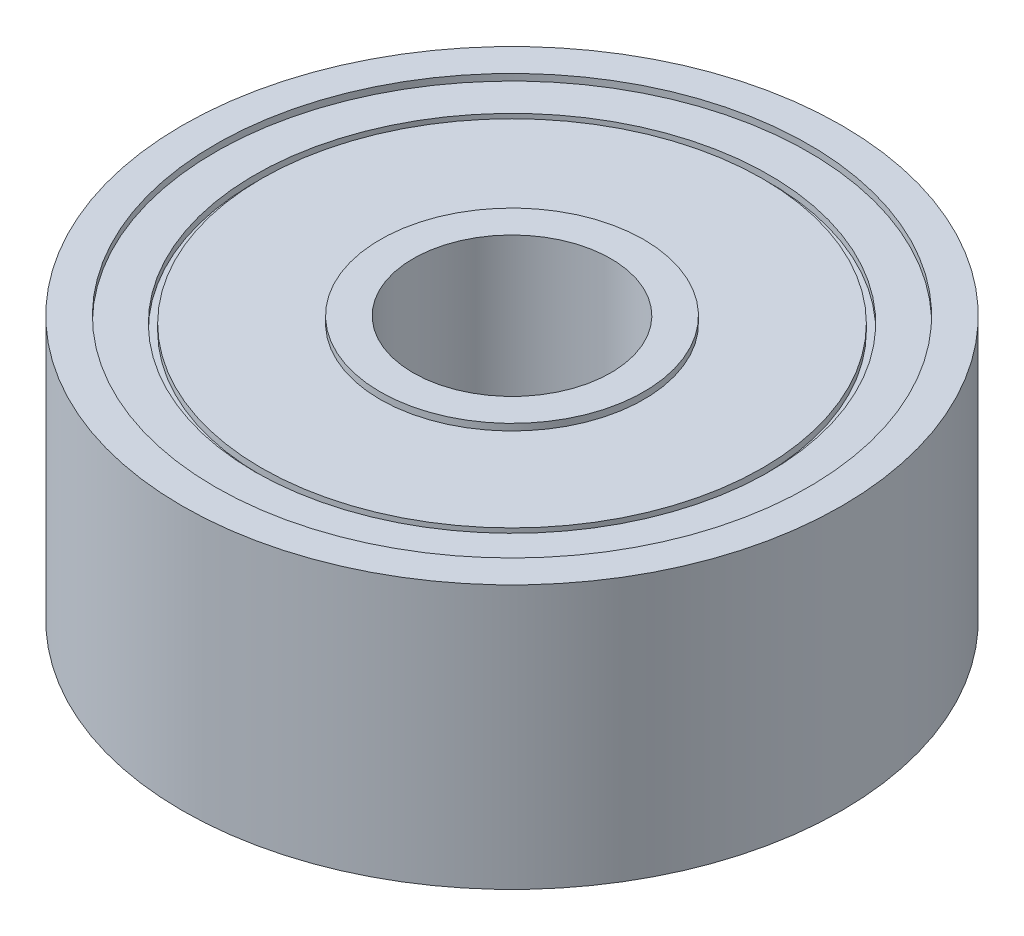
from build123d import *

# Parameters (mm, degrees)
SKETCH_1_R          = 5
SKETCH_1_R_2        = 1.5
EXTRUDE_1_DEPTH     = 2
SKETCH_2_R          = 4.5
SKETCH_2_R_2        = 2
CUT_EXTRUDE_1_DEPTH = 0.1
SKETCH_4_R          = 3.9
SKETCH_4_R_2        = 3.8
CUT_EXTRUDE_2_DEPTH = 0.1


with BuildPart() as part:
    # Эскиз1 → Бобышка-Вытянуть1 (new, symmetric)
    with BuildSketch(Plane(origin=(0, 0, 0), x_dir=(1, 0, 0), z_dir=(0, 1, 0))):
        with Locations(Location((0, 0, 0), (0, 0, 270))):
            Circle(SKETCH_1_R)
        with Locations(Location((0, 0, 0), (0, 0, 270))):
            Circle(SKETCH_1_R_2, mode=Mode.SUBTRACT)
    extrude(amount=EXTRUDE_1_DEPTH, both=True)

    # Эскиз2 → Вырез-Вытянуть1 (cut)
    with BuildSketch(Plane(origin=(0, 2, 0), x_dir=(1, 0, 0), z_dir=(0, 1, 0))):
        with Locations(Location((0, 0, 0), (0, 0, 270))):
            Circle(SKETCH_2_R)
        with Locations(Location((0, 0, 0), (0, 0, 270))):
            Circle(SKETCH_2_R_2, mode=Mode.SUBTRACT)
    cut_extrude_1 = extrude(amount=-CUT_EXTRUDE_1_DEPTH, mode=Mode.SUBTRACT)

    # Эскиз4 → Вырез-Вытянуть2 (cut)
    with BuildSketch(Plane(origin=(0, 1.9, 0), x_dir=(1, 0, 0), z_dir=(0, 1, 0))):
        with Locations(Location((0, 0, 0), (0, 0, 270))):
            Circle(SKETCH_4_R)
        with Locations(Location((0, 0, 0), (0, 0, 270))):
            Circle(SKETCH_4_R_2, mode=Mode.SUBTRACT)
    cut_extrude_2 = extrude(amount=-CUT_EXTRUDE_2_DEPTH, mode=Mode.SUBTRACT)

    # Зеркальное отражение1: Вырез-Вытянуть1, Вырез-Вытянуть2 across plane
    add(cut_extrude_1.mirror(Plane.ZX), mode=Mode.SUBTRACT)
    add(cut_extrude_2.mirror(Plane.ZX), mode=Mode.SUBTRACT)


solid = part.part
